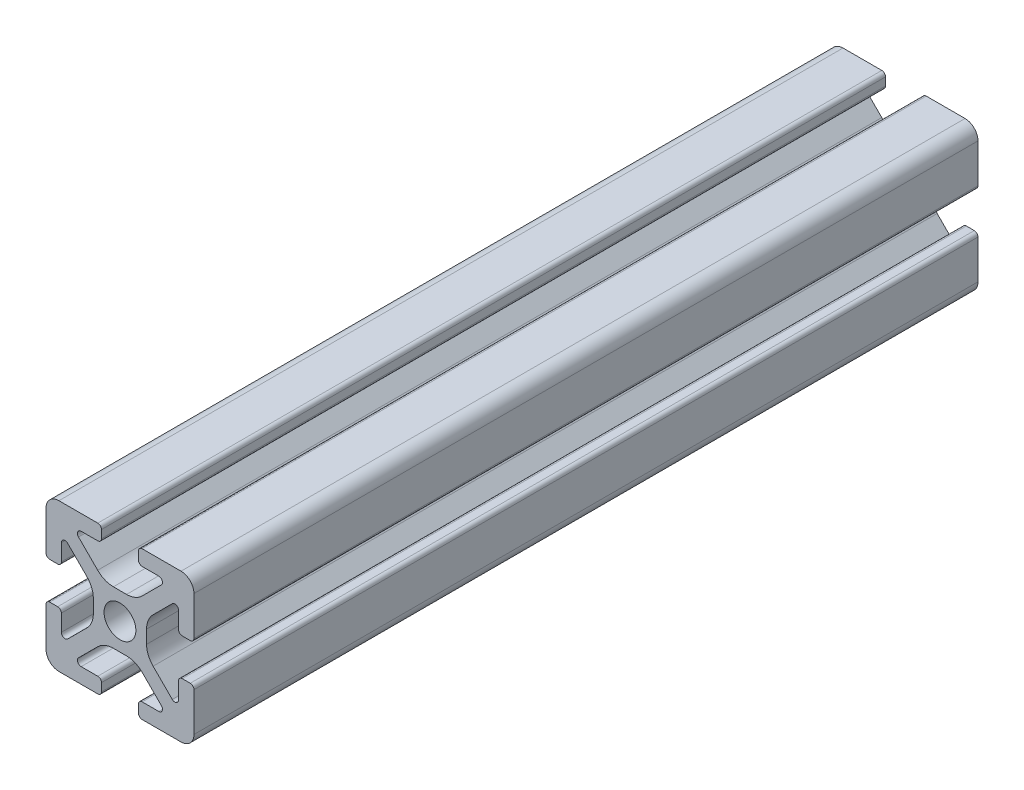
from build123d import *

# Parameters (mm, degrees)
BOSS_EXTRUDE1_DEPTH = 304.8
SKETCH5_W           = 26.995197012
SKETCH5_H           = 24.68705749
CUT_EXTRUDE1_DEPTH  = 503.6


with BuildPart() as part:
    # Sketch4 → Boss-Extrude1 (new, symmetric)
    with BuildSketch(Plane.XY):
        with BuildLine():
            Line((3, -10), (8.25, -10))
            ThreePointArc((8.25, -10), (9.487436867, -9.487436867), (10, -8.25))
            Line((10, -8.25), (10, -3))
            ThreePointArc((10, -3), (9.853553391, -2.646446609), (9.5, -2.5))
            Line((9.5, -2.5), (8.424621202, -2.5))
            ThreePointArc((8.424621202, -2.5), (8.071067812, -2.646446609), (7.924621202, -3))
            Line((7.924621202, -3), (7.924621202, -5.25))
            ThreePointArc((7.924621202, -5.25), (7.615962919, -5.711939766), (7.071067812, -5.603553391))
            Line((7.071067812, -5.603553391), (4.478679656, -3.011165235))
            ThreePointArc((4.478679656, -3.011165235), (3.828361402, -2.037895189), (3.6, -0.889844892))
            Line((3.6, -0.889844892), (3.6, 0))
            Line((3.6, 0), (2.15, 0))
            ThreePointArc((2.15, 0), (1.52027958, -1.52027958), (0, -2.15))
            Line((0, -2.15), (0, -3.6))
            Line((0, -3.6), (0.889844892, -3.6))
            ThreePointArc((0.889844892, -3.6), (2.037895189, -3.828361402), (3.011165235, -4.478679656))
            Line((3.011165235, -4.478679656), (5.603553391, -7.071067812))
            ThreePointArc((5.603553391, -7.071067812), (5.711939766, -7.615962919), (5.25, -7.924621202))
            Line((5.25, -7.924621202), (3, -7.924621202))
            ThreePointArc((3, -7.924621202), (2.646446609, -8.071067812), (2.5, -8.424621202))
            Line((2.5, -8.424621202), (2.5, -9.5))
            ThreePointArc((2.5, -9.5), (2.646446609, -9.853553391), (3, -10))
        make_face()
    extrude(amount=BOSS_EXTRUDE1_DEPTH, both=True)

    # Mirror1: part across plane


with BuildPart() as part_1:
    add(part.part)
    add(part.part.mirror(Plane(origin=(0, 0, 0), x_dir=(0, 0, 1), z_dir=(1, 0, 0))))

    # Mirror2: part across plane


with BuildPart() as part_2:
    add(part_1.part)
    add(part_1.part.mirror(Plane.ZX))

    # Sketch5 → Cut-Extrude1 (cut)
    with BuildSketch(Plane(origin=(0, 0, -304.8), x_dir=(-1, 0, 0), z_dir=(0, 0, -1))):
        with Locations((-0.333544011, -0.025224209)):
            Rectangle(SKETCH5_W, SKETCH5_H)
    extrude(amount=-CUT_EXTRUDE1_DEPTH, mode=Mode.SUBTRACT)


solid = part_2.part
